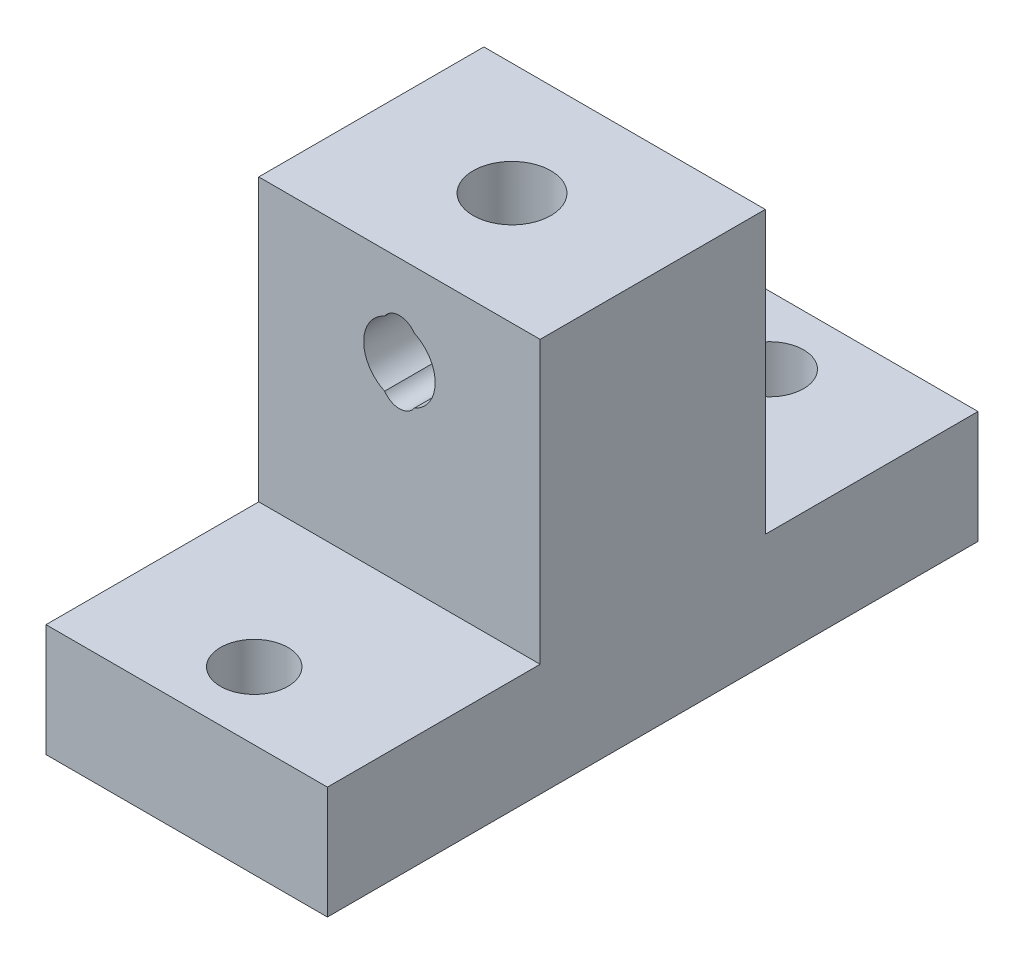
from build123d import *

# Parameters (mm, degrees)
SKETCH1_W                          = 12.5
SKETCH1_H                          = 28.9
EXTRUDE1_DEPTH                     = 5
F_3_0_3_DIAMETER_HOLE1_D           = 3
SKETCH5_W                          = 12.5
SKETCH5_H                          = 10
EXTRUDE3_DEPTH                     = 12.5
F_1_8_0_125_DIAMETER_HOLE1_D       = 3.175
F_8_32_TAPPED_HOLE1_D              = 3.4544
F_8_32_TAPPED_HOLE1_ON_FACE_2_D    = 3.4544
F_1_16_0_0625_DIAMETER_HOLE2_D     = 1.5875
F_1_16_0_0625_DIAMETER_HOLE2_DEPTH = 19.45
F_1_16_0_0625_DIAMETER_HOLE2_TIP   = 0.476933116


with BuildPart() as part:
    # Sketch1 → Extrude1 (new body)
    with BuildSketch(Plane(origin=(0, 0, 0), x_dir=(1, 0, 0), z_dir=(0, 1, 0))):
        Rectangle(SKETCH1_W, SKETCH1_H)
    extrude(amount=EXTRUDE1_DEPTH)

    # Ø3.0 (3) Diameter Hole1 (through all)
    with Locations(Plane(origin=(0, 5, -11.45), x_dir=(0, 0, 1), z_dir=(0, 1, 0))):
        with Locations((0, 0), (22.9, 0)):
            Hole(F_3_0_3_DIAMETER_HOLE1_D / 2)

    # Sketch5 → Extrude3 (add)
    with BuildSketch(Plane(origin=(0, 5, 0), x_dir=(1, 0, 0), z_dir=(0, 1, 0))):
        Rectangle(SKETCH5_W, SKETCH5_H)
    extrude(amount=EXTRUDE3_DEPTH)

    # 1/8 (0.125) Diameter Hole1 (through all)
    with Locations(Plane(origin=(0, 13.5, -5), x_dir=(-1, 0, 0), z_dir=(0, 0, -1))):
        with Locations((0, 0)):
            Hole(F_1_8_0_125_DIAMETER_HOLE1_D / 2)

    # #8-32 Tapped Hole1 (through all)
    with Locations(Plane.ZX.offset(17.5)):
        with Locations((0, 0)):
            Hole(F_8_32_TAPPED_HOLE1_D / 2)

    # #8-32 Tapped Hole1 on face 2 (through all)
    with Locations(Plane(origin=(0, 0, 0), x_dir=(0, 0, -1), z_dir=(0, -1, 0))):
        with Locations((0, 0)):
            Hole(F_8_32_TAPPED_HOLE1_ON_FACE_2_D / 2)

    # 1/16 (0.0625) Diameter Hole2
    with Locations(Plane(origin=(0, 14.5, -5), x_dir=(-1, 0, 0), z_dir=(0, 0, -1))):
        with Locations((0, 0), (0, -2)):
            Hole(F_1_16_0_0625_DIAMETER_HOLE2_D / 2, depth=F_1_16_0_0625_DIAMETER_HOLE2_DEPTH)
            with Locations((0, 0, -(F_1_16_0_0625_DIAMETER_HOLE2_DEPTH + F_1_16_0_0625_DIAMETER_HOLE2_TIP / 2))):  # 118° drill point
                Cone(0, F_1_16_0_0625_DIAMETER_HOLE2_D / 2, F_1_16_0_0625_DIAMETER_HOLE2_TIP, mode=Mode.SUBTRACT)


solid = part.part
